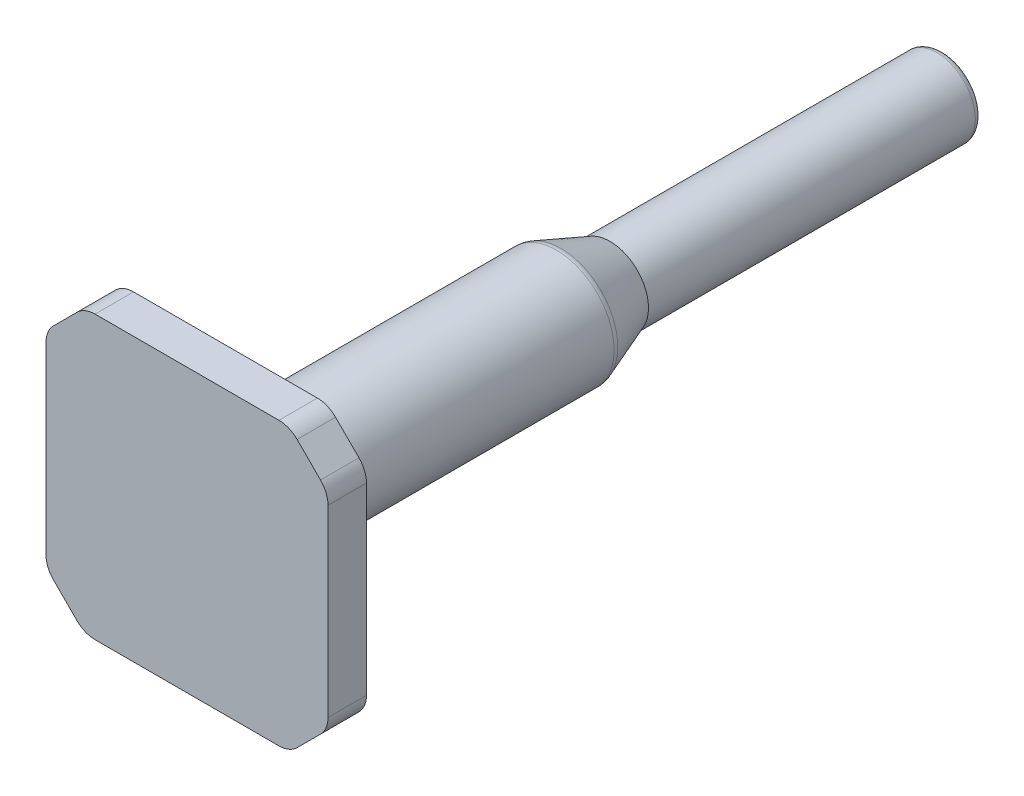
from build123d import *

# Parameters (mm, degrees)
SKETCH1_W           = 22
SKETCH1_H           = 22
BOSS_EXTRUDE1_DEPTH = 3
SKETCH1_3_R         = 4.5
BOSS_EXTRUDE2_DEPTH = 30
SKETCH2_R           = 3
BOSS_EXTRUDE3_DEPTH = 26
FILLET1_R           = 0.5
FILLET4_R           = 0.5
FILLET5_R           = 1
CHAMFER2_SIZE       = 3
FILLET7_R           = 2


with BuildPart() as part:
    # Sketch1 → Boss-Extrude1 (new body)
    with BuildSketch(Plane.XY):
        Rectangle(SKETCH1_W, SKETCH1_H)
    extrude(amount=BOSS_EXTRUDE1_DEPTH)

    # Sketch1<3> → Boss-Extrude2 (add)
    with BuildSketch(Plane.XY):
        Circle(SKETCH1_3_R)
    extrude(amount=-BOSS_EXTRUDE2_DEPTH)

    # Sketch2 → Boss-Extrude3 (add)
    with BuildSketch(Plane(origin=(0, 0, -30), x_dir=(-1, 0, 0), z_dir=(0, 0, -1))):
        Circle(SKETCH2_R)
    extrude(amount=BOSS_EXTRUDE3_DEPTH)

    # Sketch3 → Cut-Revolve1 (revolve, cut)
    with BuildSketch(Plane(origin=(0, 0, 0), x_dir=(0, 0, -1), z_dir=(1, 0, 0))):
        Polygon((30, 3), (26, 4.5), (30, 4.5), align=None)
    revolve(axis=Axis((0, 0, -30), (0, 0, 1)), mode=Mode.SUBTRACT)

    # Fillet1
    fillet1_edges = [part.edges().sort_by_distance(p)[0] for p in [
        (-4.5, 0, 0),
    ]]
    fillet(fillet1_edges, radius=FILLET1_R)

    # Fillet4
    fillet4_edges = [part.edges().sort_by_distance(p)[0] for p in [
        (3, 0, -56),
    ]]
    fillet(fillet4_edges, radius=FILLET4_R)

    # Fillet5
    fillet5_edges = [part.edges().sort_by_distance(p)[0] for p in [
        (-3.181980515, -3.181980515, -26),
    ]]
    fillet(fillet5_edges, radius=FILLET5_R)

    # Chamfer2
    chamfer2_edges = [part.edges().sort_by_distance(p)[0] for p in [
        (11, 11, 1.5),
        (-11, 11, 1.5),
        (-11, -11, 1.5),
        (11, -11, 1.5),
    ]]
    chamfer(chamfer2_edges, length=CHAMFER2_SIZE)

    # Fillet7
    fillet7_edges = [part.edges().sort_by_distance(p)[0] for p in [
        (8, -11, 1.5),
        (11, -8, 1.5),
        (-11, -8, 1.5),
        (-8, -11, 1.5),
        (-11, 8, 1.5),
        (-8, 11, 1.5),
        (11, 8, 1.5),
        (8, 11, 1.5),
    ]]
    fillet(fillet7_edges, radius=FILLET7_R)


solid = part.part
